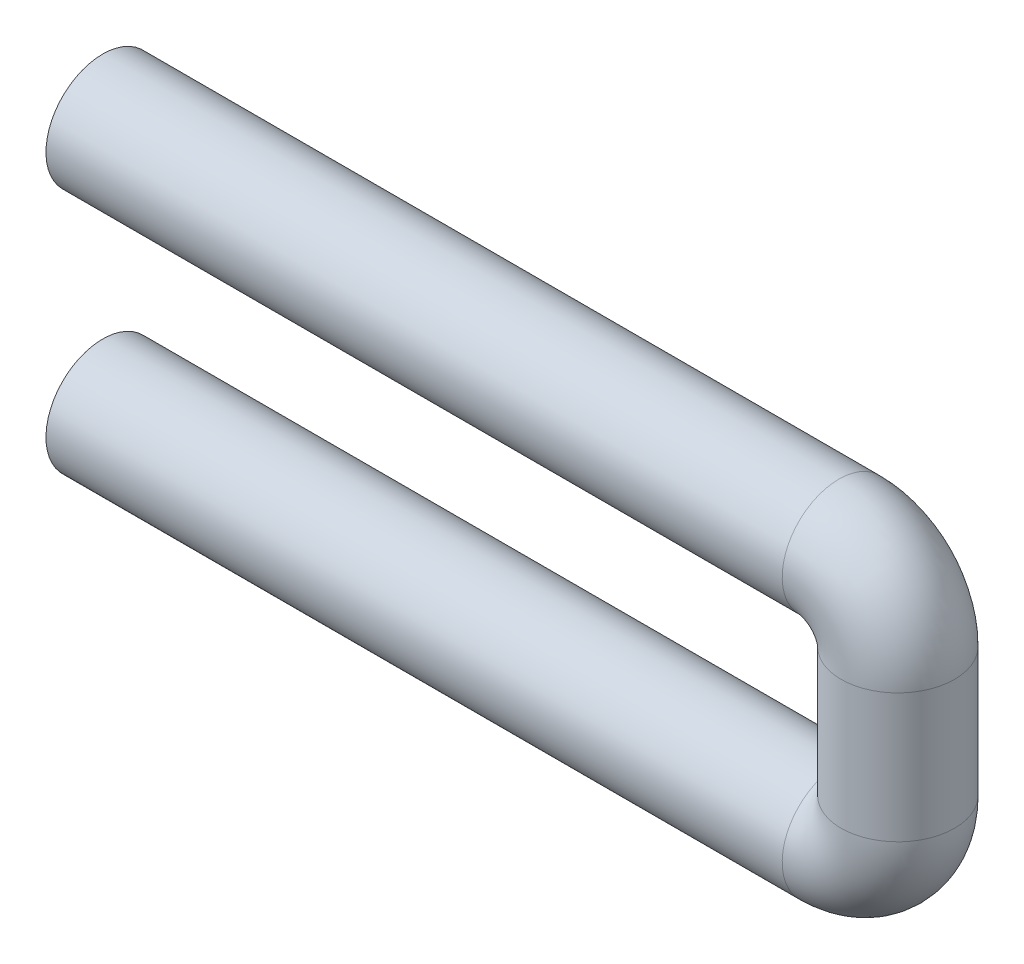
from build123d import *

# Parameters (mm, degrees)
IZIM3_R = 1.3


with BuildPart() as part:
    # Süpür1: sweep along a path in Çizim1
    with BuildLine(Plane.XY) as s_p_r1_path:
        Line((-6.485456768, -9.587742445), (10.384543232, -9.587742445))
        ThreePointArc((10.384543232, -9.587742445), (11.339137386, -9.1923366), (11.734543232, -8.237742445))
        Line((11.734543232, -8.237742445), (11.734543232, -5.283104638))
        ThreePointArc((11.734543232, -5.283104638), (11.339137386, -4.328510484), (10.384543232, -3.933104638))
        Line((10.384543232, -3.933104638), (-6.485456768, -3.933104638))
    # Çizim3 → Süpür1 (sweep)
    with BuildSketch(Plane(origin=(-6.485456768, -9.587742445, 0), x_dir=(0, 0, 1), z_dir=(-1, 0, 0))):
        Circle(IZIM3_R)
    sweep(path=s_p_r1_path.line)


solid = part.part
